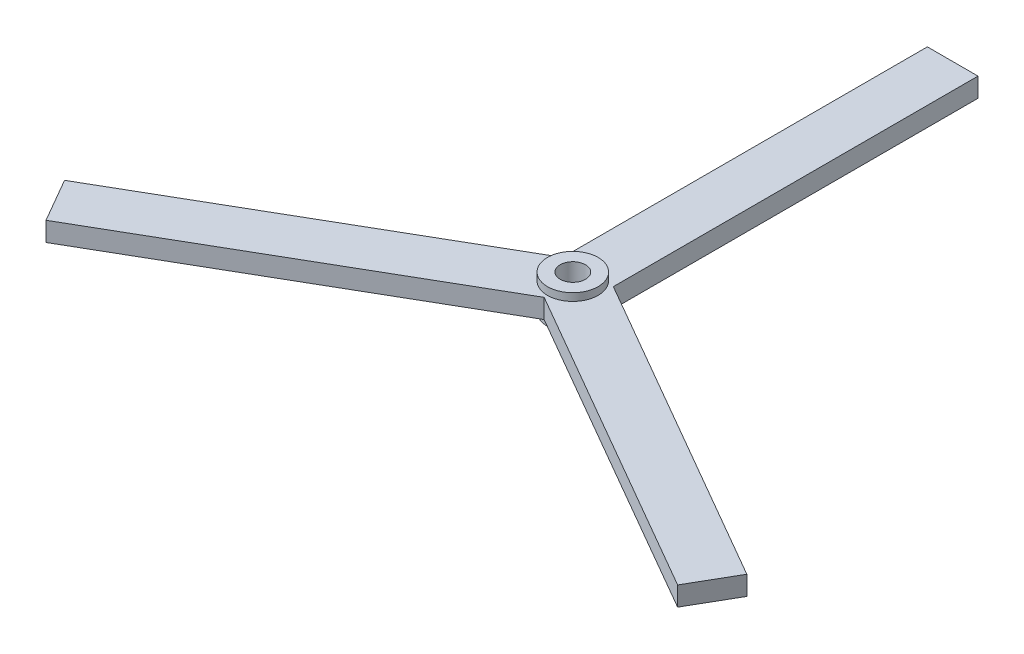
from build123d import *

# Parameters (mm, degrees)
SKETCH_1_R      = 5
SKETCH_1_R_2    = 2.5
EXTRUDE_1_DEPTH = 3.4
SKETCH_2_R      = 5
EXTRUDE_2_DEPTH = 1.9


with BuildPart() as part:
    # 草图1 → 凸台-拉伸1 (new, symmetric)
    with BuildSketch(Plane(origin=(0, 0, 0), x_dir=(1, 0, 0), z_dir=(0, 1, 0))):
        with Locations(Location((0, 0, 0), (0, 0, 270))):
            Circle(SKETCH_1_R)
        with Locations(Location((0, 0, 0), (0, 0, 270))):
            Circle(SKETCH_1_R_2, mode=Mode.SUBTRACT)
    extrude(amount=EXTRUDE_1_DEPTH, both=True)

    # 草图2 → 凸台-拉伸2 (add, symmetric)
    with BuildSketch(Plane(origin=(0, 0, 0), x_dir=(1, 0, 0), z_dir=(0, 1, 0))):
        Polygon((5, 3.002496099), (5, 75), (-5, 75), (-5, 3.002496099), (-67.351667387, -32.996255851), (-62.351667387, -41.656509889), (0, -5.657757939), (62.351667387, -41.656509889), (67.351667387, -32.996255851), align=None)
        with Locations(Location((0, 0, 0), (0, 0, 270))):
            Circle(SKETCH_2_R, mode=Mode.SUBTRACT)
    extrude(amount=EXTRUDE_2_DEPTH, both=True)


solid = part.part
